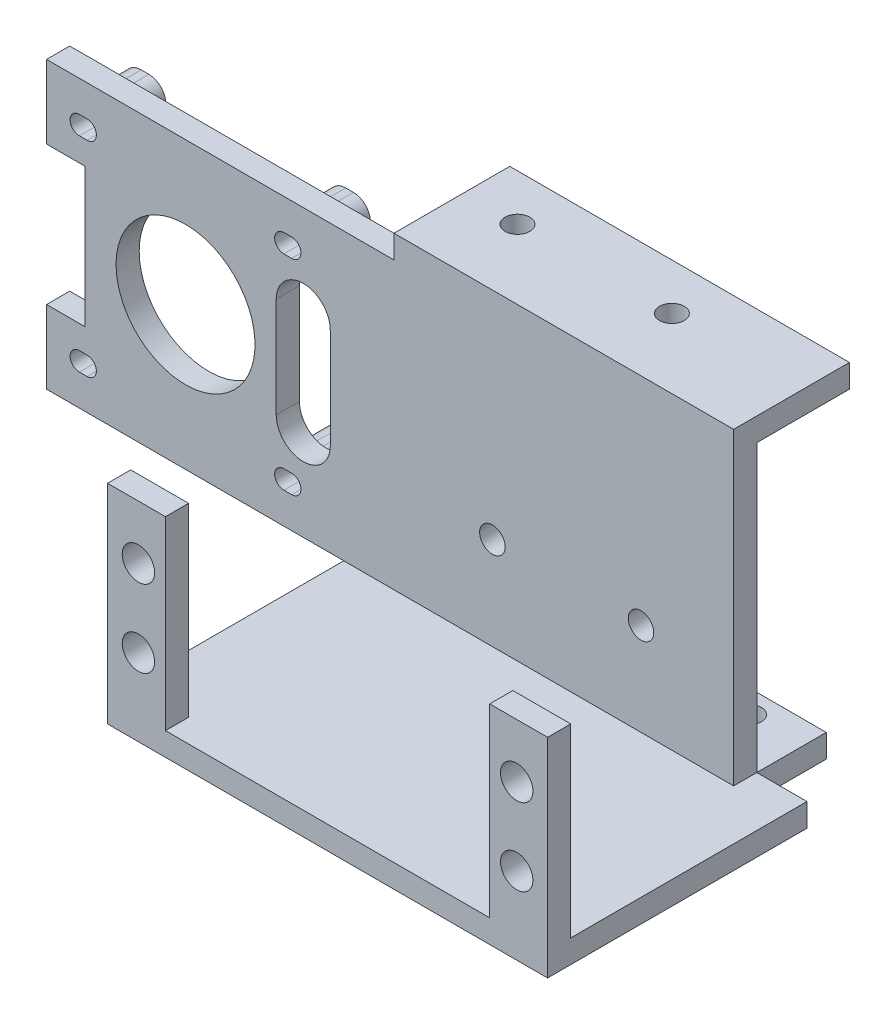
from build123d import *
from build123d.topology import SkipClean

# Parameters (mm, degrees)
SKETCH_1_W                = 57
SKETCH_1_H                = 51
EXTRUDE_1_DEPTH           = 3
SKETCH_3_W                = 44
SKETCH_3_H                = 3
EXTRUDE_3_DEPTH           = 24
SKETCH_5_W                = 57
SKETCH_5_H                = 3
EXTRUDE_4_DEPTH           = 24
SKETCH_7_R                = 2.1
CUT_EXTRUDE_1_DEPTH       = 3
SKETCH_8_W                = 42
SKETCH_8_H                = 24
CUT_EXTRUDE_2_DEPTH       = 3
SKETCH_10_W               = 44
SKETCH_10_H               = 3
EXTRUDE_5_DEPTH           = 55
SKETCH_11_R               = 2.25
EXTRUDE_6_DEPTH           = 8
SKETCH_12_W               = 13
SKETCH_12_H               = 8
CUT_EXTRUDE_4_DEPTH       = 8
SKETCH_13_R               = 1.1
CUT_EXTRUDE_5_DEPTH       = 5
SKETCH_14_W               = 44
SKETCH_14_H               = 3
EXTRUDE_7_DEPTH           = 6
SKETCH_15_W               = 44
SKETCH_15_H               = 3
EXTRUDE_8_DEPTH           = 9
SKETCH_16_R               = 1.6
CUT_EXTRUDE_6_DEPTH       = 9
SKETCH_17_R               = 1.6
CUT_EXTRUDE_8_DEPTH       = 9
SKETCH_18_W               = 57
SKETCH_18_H               = 17.6
EXTRUDE_9_DEPTH           = 3
SKETCH_19_W               = 57
SKETCH_19_H               = 3
EXTRUDE_10_DEPTH          = 25
SKETCH_20_W               = 51.895035654
SKETCH_20_H               = 47.139393347
CUT_EXTRUDE_9_DEPTH       = 10
SKETCH_21_W               = 3
SKETCH_21_H               = 32
EXTRUDE_11_DEPTH          = 34
SKETCH_22_R               = 2.25
SKETCH_22_R_2             = 1.2
EXTRUDE_12_DEPTH          = 5
SKETCH_24_R               = 9
CUT_EXTRUDE_11_DEPTH      = 5
SKETCH_25_R               = 1.65
CUT_EXTRUDE_12_DEPTH      = 10
SKETCH_26_R               = 1.1
SKETCH_26_R_2             = 1.2
CUT_EXTRUDE_13_DEPTH      = 10
SKETCH_27_W               = 20.53
SKETCH_27_H               = 21
CUT_EXTRUDE_14_DEPTH      = 10
SKETCH_28_W               = 44
SKETCH_28_H               = 3
EXTRUDE_13_DEPTH          = 3
SKETCH_29_W               = 44
SKETCH_29_H               = 3
EXTRUDE_14_DEPTH          = 3
SKETCH_30_R               = 1.6
CUT_EXTRUDE_15_DEPTH      = 3
SKETCH_33_R               = 1.65
CUT_EXTRUDE_16_DEPTH      = 3
SKETCH_34_W               = 3
SKETCH_34_H               = 37
EXTRUDE_15_DEPTH          = 45
EXTRUDE_17_DEPTH          = 5
CUT_EXTRUDE_18_DEPTH      = 5
SKETCH_35_4_R             = 9
CUT_EXTRUDE_19_DEPTH      = 5
SKETCH_37_W               = 10
SKETCH_37_H               = 18
CUT_EXTRUDE_20_DEPTH      = 5
CUT_EXTRUDE_21_DEPTH      = 90.143760298
CUT_EXTRUDE_21_DEPTH_BACK = 90.143760298
SKETCH_32_W               = 94.930204489
SKETCH_32_H               = 40.916543237


with BuildPart() as part:
    # 草图1 → 凸台-拉伸1 (new body)
    with BuildSketch(Plane(origin=(0, 0, 0), x_dir=(1, 0, 0), z_dir=(0, 1, 0))):
        Rectangle(SKETCH_1_W, SKETCH_1_H)
    extrude(amount=EXTRUDE_1_DEPTH)

    # 草图3 → 凸台-拉伸3 (add)
    with BuildSketch(Plane(origin=(0, 3, 0), x_dir=(1, 0, 0), z_dir=(0, 1, 0))):
        with Locations((0, 24)):
            Rectangle(SKETCH_3_W, SKETCH_3_H)
    extrude(amount=EXTRUDE_3_DEPTH)

    # 草图5 → 凸台-拉伸4 (add)
    with BuildSketch(Plane(origin=(0, 3, 0), x_dir=(1, 0, 0), z_dir=(0, 1, 0))):
        with Locations((0, -6.6)):
            Rectangle(SKETCH_5_W, SKETCH_5_H)
    extrude(amount=EXTRUDE_4_DEPTH)

    # 草图7 → 切除-拉伸1 (cut)
    with BuildSketch(Plane(origin=(0, 0, 5.1), x_dir=(-1, 0, 0), z_dir=(0, 0, -1))):
        with Locations((-24.5, 20)):
            Circle(SKETCH_7_R)
        with Locations((-24.5, 10)):
            Circle(SKETCH_7_R)
        with Locations((24.5, 20)):
            Circle(SKETCH_7_R)
        with Locations((24.5, 10)):
            Circle(SKETCH_7_R)
    extrude(amount=-CUT_EXTRUDE_1_DEPTH, mode=Mode.SUBTRACT)

    # 草图8 → 切除-拉伸2 (cut)
    with BuildSketch(Plane(origin=(0, 0, 5.1), x_dir=(-1, 0, 0), z_dir=(0, 0, -1))):
        with Locations((0, 15)):
            Rectangle(SKETCH_8_W, SKETCH_8_H)
    extrude(amount=-CUT_EXTRUDE_2_DEPTH, mode=Mode.SUBTRACT)

    # 草图10 → 凸台-拉伸5 (add)
    with BuildSketch(Plane(origin=(0, 27, 0), x_dir=(1, 0, 0), z_dir=(0, 1, 0))):
        with Locations((0, 24)):
            Rectangle(SKETCH_10_W, SKETCH_10_H)
    extrude(amount=EXTRUDE_5_DEPTH)

    # 草图11 → 凸台-拉伸6 (add)
    with BuildSketch(Plane(origin=(0, 0, -25.5), x_dir=(-1, 0, 0), z_dir=(0, 0, -1))):
        with Locations((-13.2, 85)):
            Circle(SKETCH_11_R)
        with Locations((13.2, 85)):
            Circle(SKETCH_11_R)
        with Locations((-13.2, 58.6)):
            Circle(SKETCH_11_R)
        with Locations((13.2, 58.6)):
            Circle(SKETCH_11_R)
    extrude(amount=-EXTRUDE_6_DEPTH)


with BuildPart() as extrude_6_piece_1:
    # of the separate pieces the step leaves, piece 1, a body of its own (extrude_6_pieces)
    add(part.part.solids().sort_by_distance((-28.5, 0, -25.5))[0])

    # 草图12 → 切除-拉伸4 (cut)
    with BuildSketch(Plane.XY.offset(-22.5)):
        with Locations((-3.7, 58.6)):
            Rectangle(SKETCH_12_W, SKETCH_12_H)
    extrude(amount=-CUT_EXTRUDE_4_DEPTH, mode=Mode.SUBTRACT)

    # 草图13 → 切除-拉伸5 (cut)
    with BuildSketch(Plane.XY.offset(-17.5)):
        with Locations((13.2, 85)):
            Circle(SKETCH_13_R)
        with Locations((-13.2, 85)):
            Circle(SKETCH_13_R)
        with Locations((-13.2, 58.6)):
            Circle(SKETCH_13_R)
        with Locations((13.2, 58.6)):
            Circle(SKETCH_13_R)
    extrude(amount=-CUT_EXTRUDE_5_DEPTH, mode=Mode.SUBTRACT)

    # 草图14 → 凸台-拉伸7 (add)
    with BuildSketch(Plane(origin=(0, 0, -25.5), x_dir=(-1, 0, 0), z_dir=(0, 0, -1))):
        with Locations((0, 1.5)):
            Rectangle(SKETCH_14_W, SKETCH_14_H)
    extrude(amount=EXTRUDE_7_DEPTH)

    # 草图15 → 凸台-拉伸8 (add)
    with BuildSketch(Plane(origin=(0, 0, -25.5), x_dir=(-1, 0, 0), z_dir=(0, 0, -1))):
        with Locations((0, 41.5)):
            Rectangle(SKETCH_15_W, SKETCH_15_H)
    extrude(amount=EXTRUDE_8_DEPTH)

    # 草图16 → 切除-拉伸6 (cut)
    with BuildSketch(Plane(origin=(0, 40, 0), x_dir=(-1, 0, 0), z_dir=(0, -1, 0))):
        with Locations((15, 31.5)):
            Circle(SKETCH_16_R)
        with Locations((-5, 31.5)):
            Circle(SKETCH_16_R)
    extrude(amount=-CUT_EXTRUDE_6_DEPTH, mode=Mode.SUBTRACT)

    # 草图17 → 切除-拉伸8 (cut)
    with BuildSketch(Plane(origin=(0, 0, 0), x_dir=(1, 0, 0), z_dir=(0, 1, 0))):
        with Locations((-5, 31.5)):
            Circle(SKETCH_17_R)
        with Locations((15, 31.5)):
            Circle(SKETCH_17_R)
    extrude(amount=CUT_EXTRUDE_8_DEPTH, mode=Mode.SUBTRACT)

    # 草图18 → 凸台-拉伸9 (add)
    with BuildSketch(Plane(origin=(0, 3, 0), x_dir=(1, 0, 0), z_dir=(0, 1, 0))):
        with Locations((0, -34.3)):
            Rectangle(SKETCH_18_W, SKETCH_18_H)
    extrude(amount=-EXTRUDE_9_DEPTH)

    # 草图19 → 凸台-拉伸10 (add)
    with BuildSketch(Plane(origin=(0, 3, 0), x_dir=(1, 0, 0), z_dir=(0, 1, 0))):
        with Locations((0, -41.6)):
            Rectangle(SKETCH_19_W, SKETCH_19_H)
    extrude(amount=EXTRUDE_10_DEPTH)


with BuildPart() as extrude_6_piece_2:
    # of the separate pieces the step leaves, piece 2, a body of its own (extrude_6_pieces)
    add(part.part.solids().sort_by_distance((-15.45, 85, -25.5))[0])


with BuildPart() as extrude_6_piece_3:
    # of the separate pieces the step leaves, piece 3, a body of its own (extrude_6_pieces)
    add(part.part.solids().sort_by_distance((10.95, 85, -25.5))[0])


with BuildPart() as cut_extrude_9_tool:
    # 草图20 → 切除-拉伸9 (new body)
    with BuildSketch(Plane(origin=(0, 0, -25.5), x_dir=(-1, 0, 0), z_dir=(0, 0, -1))):
        with Locations((-3.947517827, 66.569696674)):
            Rectangle(SKETCH_20_W, SKETCH_20_H)
    extrude(amount=-CUT_EXTRUDE_9_DEPTH)


with BuildPart() as extrude_6_piece_1_1:
    add(extrude_6_piece_1.part)

    # 切除-拉伸9: cut by cut_extrude_9_tool
    add(cut_extrude_9_tool.part, mode=Mode.SUBTRACT)

    # 草图21 → 凸台-拉伸11 (add)
    with BuildSketch(Plane.ZY.offset(28.5)):
        with Locations((41.6, 16)):
            Rectangle(SKETCH_21_W, SKETCH_21_H)
    extrude(amount=EXTRUDE_11_DEPTH)

    # 草图22 → 凸台-拉伸12 (add)
    # profile 1 of 4: a face of its own
    with BuildSketch(Plane(origin=(0, 0, 40.1), x_dir=(-1, 0, 0), z_dir=(0, 0, -1))):
        with Locations((59.75, 2.75)):
            Circle(SKETCH_22_R)
        with Locations((59.75, 2.75)):
            Circle(SKETCH_22_R_2, mode=Mode.SUBTRACT)
    # profile 2 of 4: a face of its own
    with BuildSketch(Plane(origin=(0, 0, 40.1), x_dir=(-1, 0, 0), z_dir=(0, 0, -1))):
        with Locations((59.75, 29.25)):
            Circle(SKETCH_22_R)
        with Locations((59.75, 29.25)):
            Circle(SKETCH_22_R_2, mode=Mode.SUBTRACT)
    # profile 3 of 4: a face of its own
    with BuildSketch(Plane(origin=(0, 0, 40.1), x_dir=(-1, 0, 0), z_dir=(0, 0, -1))):
        with Locations((33.25, 29.25)):
            Circle(SKETCH_22_R)
        with Locations((33.25, 29.25)):
            Circle(SKETCH_22_R_2, mode=Mode.SUBTRACT)
    # profile 4 of 4: a face of its own
    with BuildSketch(Plane(origin=(0, 0, 40.1), x_dir=(-1, 0, 0), z_dir=(0, 0, -1))):
        with Locations((33.25, 2.75)):
            Circle(SKETCH_22_R)
        with Locations((33.25, 2.75)):
            Circle(SKETCH_22_R_2, mode=Mode.SUBTRACT)
    extrude(amount=EXTRUDE_12_DEPTH)

    # 草图24 → 切除-拉伸11 (cut)
    with BuildSketch(Plane(origin=(0, 0, 40.1), x_dir=(-1, 0, 0), z_dir=(0, 0, -1))):
        with Locations((46.5, 16)):
            Circle(SKETCH_24_R)
    extrude(amount=-CUT_EXTRUDE_11_DEPTH, mode=Mode.SUBTRACT)

    # 草图25 → 切除-拉伸12 (cut)
    with BuildSketch(Plane.XY.offset(43.1)):
        with Locations((-9.25, 15)):
            Circle(SKETCH_25_R)
        with Locations((10, 15)):
            Circle(SKETCH_25_R)
    extrude(amount=-CUT_EXTRUDE_12_DEPTH, mode=Mode.SUBTRACT)

    # 草图26 → 切除-拉伸13 (cut)
    with BuildSketch(Plane(origin=(0, 0, 40.1), x_dir=(-1, 0, 0), z_dir=(0, 0, -1))):
        with Locations((33.25, 2.75)):
            Circle(SKETCH_26_R)
        with Locations((33.25, 29.25)):
            Circle(SKETCH_26_R_2)
        with Locations((59.75, 29.25)):
            Circle(SKETCH_26_R_2)
        with Locations((59.75, 2.75)):
            Circle(SKETCH_26_R_2)
    extrude(amount=-CUT_EXTRUDE_13_DEPTH, mode=Mode.SUBTRACT)

    # 草图27 → 切除-拉伸14 (cut)
    with BuildSketch(Plane.XY.offset(43.1)):
        with BuildLine():
            Line((-34.75, 9.5), (-34.75, 22.5))
            ThreePointArc((-34.75, 22.5), (-31.25, 26), (-27.75, 22.5))
            Line((-27.75, 22.5), (-27.75, 9.5))
            ThreePointArc((-27.75, 9.5), (-31.25, 6), (-34.75, 9.5))
        make_face()
        with Locations((-69.113685247, 16)):
            Rectangle(SKETCH_27_W, SKETCH_27_H)
    extrude(amount=-CUT_EXTRUDE_14_DEPTH, mode=Mode.SUBTRACT)

    # 草图28 → 凸台-拉伸13 (add)
    with BuildSketch(Plane.XZ):
        with Locations((0, -33)):
            Rectangle(SKETCH_28_W, SKETCH_28_H)
    extrude(amount=-EXTRUDE_13_DEPTH)

    # 草图29 → 凸台-拉伸14 (add)
    with BuildSketch(Plane(origin=(0, 43, 0), x_dir=(1, 0, 0), z_dir=(0, 1, 0))):
        with Locations((0, 36)):
            Rectangle(SKETCH_29_W, SKETCH_29_H)
    extrude(amount=-EXTRUDE_14_DEPTH)

    # 草图30 → 切除-拉伸15 (cut)
    with SkipClean():  # the faces are left unmerged after this step: merging them gives an invalid solid
        with BuildSketch(Plane.XZ):
            with Locations((15, -31.5)):
                Circle(SKETCH_30_R)
            with Locations((-5, -31.5)):
                Circle(SKETCH_30_R)
        extrude(amount=-CUT_EXTRUDE_15_DEPTH, mode=Mode.SUBTRACT)

    # 草图33 → 切除-拉伸16 (cut)
    with SkipClean():  # the faces are left unmerged after this step: merging them gives an invalid solid
        with BuildSketch(Plane.XY.offset(-22.5)):
            with Locations((-9.25, 15)):
                Circle(SKETCH_33_R)
            with Locations((10, 15)):
                Circle(SKETCH_33_R)
        extrude(amount=-CUT_EXTRUDE_16_DEPTH, mode=Mode.SUBTRACT)

    # 草图34 → 凸台-拉伸15 (add)
    with SkipClean():  # the faces are left unmerged after this step: merging them gives an invalid solid
        with BuildSketch(Plane.ZY.offset(22)):
            with Locations((-24, 21.5)):
                Rectangle(SKETCH_34_W, SKETCH_34_H)
        extrude(amount=EXTRUDE_15_DEPTH)

    # 草图35 → 凸台-拉伸17 (add)
    # profile 1 of 4: a face of its own
    with SkipClean():  # the faces are left unmerged after this step: merging them gives an invalid solid
        with BuildSketch(Plane(origin=(0, 0, -25.5), x_dir=(-1, 0, 0), z_dir=(0, 0, -1))):
            with BuildLine():
                Line((36.25, 36.95), (35.25, 36.95))
                ThreePointArc((35.25, 36.95), (33.05, 34.75), (35.25, 32.55))
                Line((35.25, 32.55), (36.25, 32.55))
                ThreePointArc((36.25, 32.55), (38.45, 34.75), (36.25, 36.95))
            make_face()
            with BuildLine():
                ThreePointArc((35.25, 33.55), (34.05, 34.75), (35.25, 35.95))
                Line((35.25, 35.95), (36.25, 35.95))
                ThreePointArc((36.25, 35.95), (37.45, 34.75), (36.25, 33.55))
                Line((36.25, 33.55), (35.25, 33.55))
            make_face(mode=Mode.SUBTRACT)
        # profile 2 of 4: a face of its own
        with BuildSketch(Plane(origin=(0, 0, -25.5), x_dir=(-1, 0, 0), z_dir=(0, 0, -1))):
            with BuildLine():
                Line((62.75, 36.95), (61.75, 36.95))
                ThreePointArc((61.75, 36.95), (59.55, 34.75), (61.75, 32.55))
                Line((61.75, 32.55), (62.75, 32.55))
                ThreePointArc((62.75, 32.55), (64.95, 34.75), (62.75, 36.95))
            make_face()
            with BuildLine():
                ThreePointArc((61.75, 33.55), (60.55, 34.75), (61.75, 35.95))
                Line((61.75, 35.95), (62.75, 35.95))
                ThreePointArc((62.75, 35.95), (63.95, 34.75), (62.75, 33.55))
                Line((62.75, 33.55), (61.75, 33.55))
            make_face(mode=Mode.SUBTRACT)
        # profile 3 of 4: a face of its own
        with BuildSketch(Plane(origin=(0, 0, -25.5), x_dir=(-1, 0, 0), z_dir=(0, 0, -1))):
            with BuildLine():
                Line((62.75, 10.45), (61.75, 10.45))
                ThreePointArc((61.75, 10.45), (59.55, 8.25), (61.75, 6.05))
                Line((61.75, 6.05), (62.75, 6.05))
                ThreePointArc((62.75, 6.05), (64.95, 8.25), (62.75, 10.45))
            make_face()
            with BuildLine():
                ThreePointArc((61.75, 7.05), (60.55, 8.25), (61.75, 9.45))
                Line((61.75, 9.45), (62.75, 9.45))
                ThreePointArc((62.75, 9.45), (63.95, 8.25), (62.75, 7.05))
                Line((62.75, 7.05), (61.75, 7.05))
            make_face(mode=Mode.SUBTRACT)
        # profile 4 of 4: a face of its own
        with BuildSketch(Plane(origin=(0, 0, -25.5), x_dir=(-1, 0, 0), z_dir=(0, 0, -1))):
            with BuildLine():
                Line((36.25, 10.45), (35.25, 10.45))
                ThreePointArc((35.25, 10.45), (33.05, 8.25), (35.25, 6.05))
                Line((35.25, 6.05), (36.25, 6.05))
                ThreePointArc((36.25, 6.05), (38.45, 8.25), (36.25, 10.45))
            make_face()
            with BuildLine():
                ThreePointArc((35.25, 7.05), (34.05, 8.25), (35.25, 9.45))
                Line((35.25, 9.45), (36.25, 9.45))
                ThreePointArc((36.25, 9.45), (37.45, 8.25), (36.25, 7.05))
                Line((36.25, 7.05), (35.25, 7.05))
            make_face(mode=Mode.SUBTRACT)
        extrude(amount=EXTRUDE_17_DEPTH)

    # 草图36 → 切除-拉伸18 (cut)
    with SkipClean():  # the faces are left unmerged after this step: merging them gives an invalid solid
        with BuildSketch(Plane(origin=(0, 0, -25.5), x_dir=(-1, 0, 0), z_dir=(0, 0, -1))):
            with BuildLine():
                Line((35.25, 7.05), (36.25, 7.05))
                ThreePointArc((36.25, 7.05), (37.45, 8.25), (36.25, 9.45))
                Line((36.25, 9.45), (35.25, 9.45))
                ThreePointArc((35.25, 9.45), (34.05, 8.25), (35.25, 7.05))
            make_face()
            with BuildLine():
                Line((61.75, 7.05), (62.75, 7.05))
                ThreePointArc((62.75, 7.05), (63.95, 8.25), (62.75, 9.45))
                Line((62.75, 9.45), (61.75, 9.45))
                ThreePointArc((61.75, 9.45), (60.55, 8.25), (61.75, 7.05))
            make_face()
            with BuildLine():
                Line((61.75, 33.55), (62.75, 33.55))
                ThreePointArc((62.75, 33.55), (63.95, 34.75), (62.75, 35.95))
                Line((62.75, 35.95), (61.75, 35.95))
                ThreePointArc((61.75, 35.95), (60.55, 34.75), (61.75, 33.55))
            make_face()
            with BuildLine():
                Line((35.25, 33.55), (36.25, 33.55))
                ThreePointArc((36.25, 33.55), (37.45, 34.75), (36.25, 35.95))
                Line((36.25, 35.95), (35.25, 35.95))
                ThreePointArc((35.25, 35.95), (34.05, 34.75), (35.25, 33.55))
            make_face()
        extrude(amount=-CUT_EXTRUDE_18_DEPTH, mode=Mode.SUBTRACT)

    # 草图35<4> → 切除-拉伸19 (cut)
    with SkipClean():  # the faces are left unmerged after this step: merging them gives an invalid solid
        with BuildSketch(Plane(origin=(0, 0, -25.5), x_dir=(-1, 0, 0), z_dir=(0, 0, -1))):
            with Locations((49, 21.5)):
                Circle(SKETCH_35_4_R)
        extrude(amount=-CUT_EXTRUDE_19_DEPTH, mode=Mode.SUBTRACT)

    # 草图37 → 切除-拉伸20 (cut)
    with SkipClean():  # the faces are left unmerged after this step: merging them gives an invalid solid
        with BuildSketch(Plane(origin=(0, 0, -25.5), x_dir=(-1, 0, 0), z_dir=(0, 0, -1))):
            with BuildLine():
                Line((30.25, 15), (30.25, 28))
                ThreePointArc((30.25, 28), (33.75, 31.5), (37.25, 28))
                Line((37.25, 28), (37.25, 15))
                ThreePointArc((37.25, 15), (33.75, 11.5), (30.25, 15))
            make_face()
            with Locations((67, 21.5)):
                Rectangle(SKETCH_37_W, SKETCH_37_H)
        extrude(amount=-CUT_EXTRUDE_20_DEPTH, mode=Mode.SUBTRACT)

    # 草图32 → 切除-拉伸21 (cut, two sides: drawn at the far end of the back side and taken through both)
    with SkipClean():  # the faces are left unmerged after this step: merging them gives an invalid solid
        with BuildSketch(Plane(origin=(0, 3, 0), x_dir=(1, 0, 0), z_dir=(0, 1, 0)).offset(-CUT_EXTRUDE_21_DEPTH_BACK)):
            with Locations((-18.965102245, -28.558271619)):
                Rectangle(SKETCH_32_W, SKETCH_32_H)
        extrude(amount=CUT_EXTRUDE_21_DEPTH + CUT_EXTRUDE_21_DEPTH_BACK, mode=Mode.SUBTRACT)


with BuildPart() as extrude_6_piece_2_1:
    add(extrude_6_piece_2.part)

    # 切除-拉伸9: cut by cut_extrude_9_tool
    add(cut_extrude_9_tool.part, mode=Mode.SUBTRACT)


with BuildPart() as extrude_6_piece_3_1:
    add(extrude_6_piece_3.part)

    # 切除-拉伸9: cut by cut_extrude_9_tool
    add(cut_extrude_9_tool.part, mode=Mode.SUBTRACT)


solid = extrude_6_piece_1_1.part
